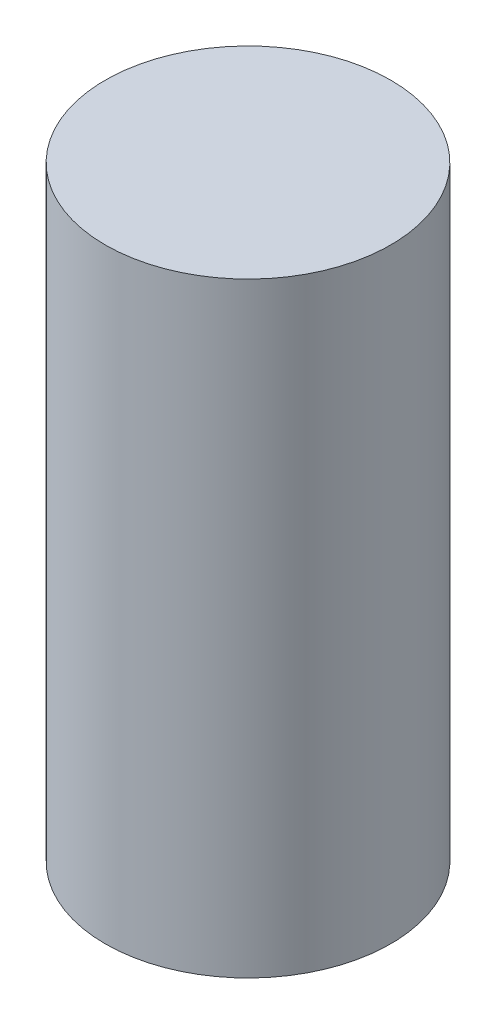
from build123d import *

# Parameters (mm, degrees)
MAIN_PARACHUTE_BAG_PROFILE_R  = 63.5
MAIN_PARACHUTE_BAG_BODY_DEPTH = 269.24


with BuildPart() as part:
    # Main Parachute Bag Profile → Main Parachute Bag Body (new body)
    with BuildSketch(Plane(origin=(0, 0, 0), x_dir=(1, 0, 0), z_dir=(0, 1, 0))):
        with Locations(Location((0, 0, 0), (0, 0, 270))):
            Circle(MAIN_PARACHUTE_BAG_PROFILE_R)
    extrude(amount=MAIN_PARACHUTE_BAG_BODY_DEPTH)


solid = part.part
